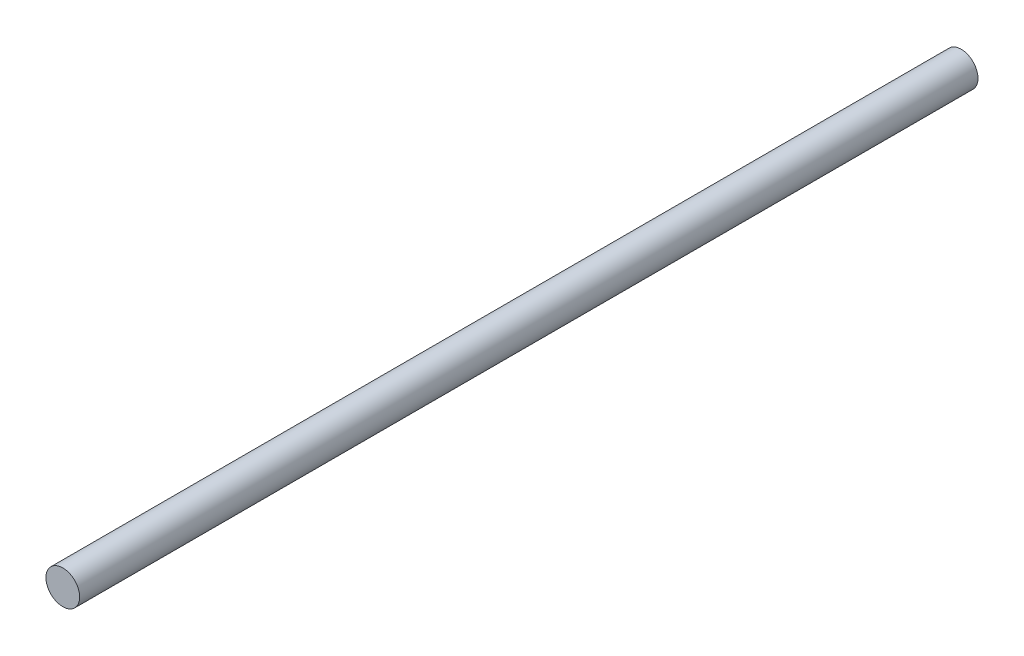
from build123d import *

# Parameters (mm, degrees)
SKETCH_1_R      = 3
EXTRUDE_1_DEPTH = 160


with BuildPart() as part:
    # 草图1 → 凸台-拉伸1 (new body)
    with BuildSketch(Plane.XY):
        Circle(SKETCH_1_R)
    extrude(amount=EXTRUDE_1_DEPTH)


solid = part.part
